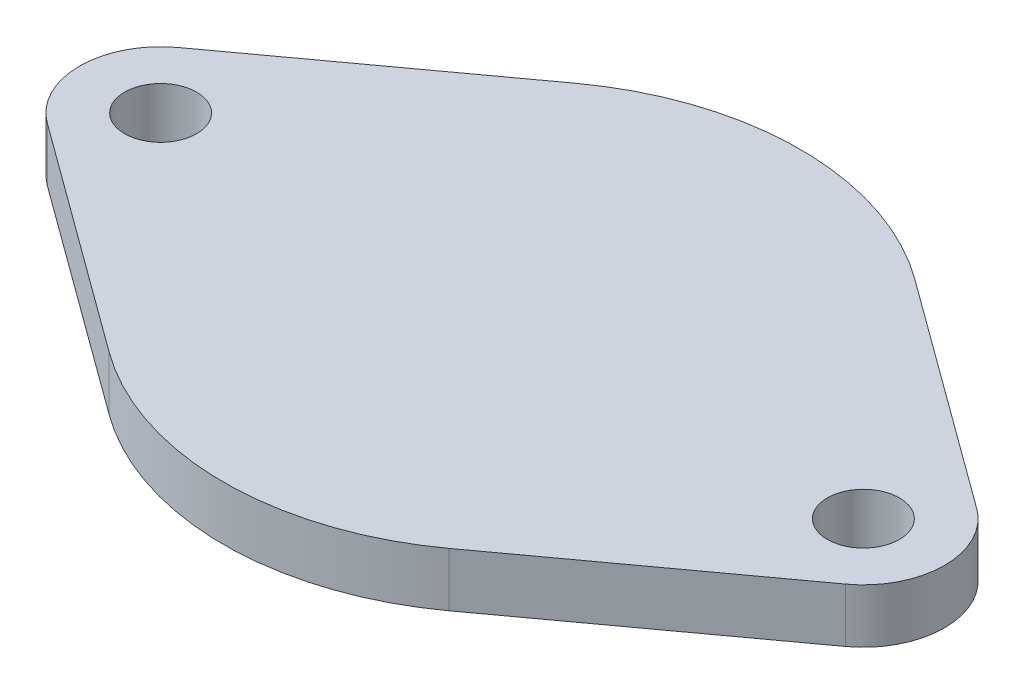
from build123d import *

# Parameters (mm, degrees)
SKETCH1_R           = 2
BOSS_EXTRUDE1_DEPTH = 3


with BuildPart() as part:
    # Sketch1 → Boss-Extrude1 (new body)
    with BuildSketch(Plane(origin=(0, 0, 0), x_dir=(1, 0, 0), z_dir=(0, 1, 0))):
        with BuildLine():
            Line((22.153846154, -3.63415748), (9.435897436, -12.921448819))
            ThreePointArc((9.435897436, -12.921448819), (0, -16), (-9.435897436, -12.921448819))
            Line((-9.435897436, -12.921448819), (-22.153846154, -3.63415748))
            ThreePointArc((-22.153846154, -3.63415748), (-24, 0), (-22.153846154, 3.63415748))
            Line((-22.153846154, 3.63415748), (-9.435897436, 12.921448819))
            ThreePointArc((-9.435897436, 12.921448819), (0, 16), (9.435897436, 12.921448819))
            Line((9.435897436, 12.921448819), (22.153846154, 3.63415748))
            ThreePointArc((22.153846154, 3.63415748), (24, 0), (22.153846154, -3.63415748))
        make_face()
        with Locations(Location((-19.5, 0, 0), (0, 0, 270))):
            Circle(SKETCH1_R, mode=Mode.SUBTRACT)
        with Locations(Location((19.5, 0, 0), (0, 0, 270))):
            Circle(SKETCH1_R, mode=Mode.SUBTRACT)
    extrude(amount=BOSS_EXTRUDE1_DEPTH)


solid = part.part
